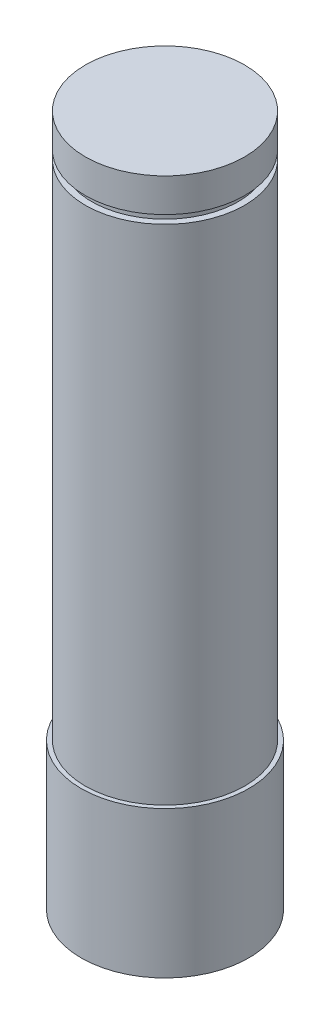
from build123d import *


with BuildPart() as part:
    # Sketch1 → Revolve1 (revolve)
    with BuildSketch(Plane.XY, mode=Mode.PRIVATE) as revolve1_sk:
        Polygon((0, 16.5), (-1.9, 16.5), (-1.9, 15.7), (-1.75, 15.7), (-1.75, 15.5), (-1.9, 15.5), (-1.9, 3.5), (-2, 3.5), (-2, 0), (0, 0), align=None)
    revolve(revolve1_sk.sketch.rotate(Axis((0, 0, 0), (0, 1, 0)), 270), axis=Axis((0, 0, 0), (0, 1, 0)))


solid = part.part
